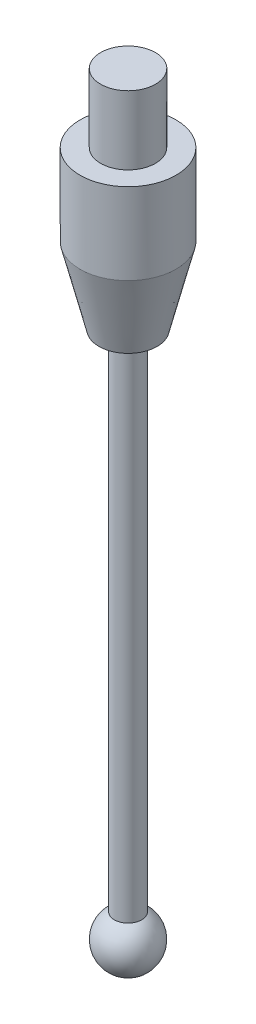
from build123d import *

# Parameters (mm, degrees)
SKETCH3_R           = 2
BOSS_EXTRUDE1_DEPTH = 5


with BuildPart() as part:
    # Sketch2 → Revolve1 (revolve)
    with BuildSketch(Plane.XY, mode=Mode.PRIVATE) as revolve1_sk:
        with BuildLine():
            Line((1, 1.732050808), (1, 38.5))
            Line((1, 38.5), (2.123066207, 38.5))
            Line((2.123066207, 38.5), (3.5, 44.068591296))
            Line((3.5, 44.068591296), (3.5, 50))
            Line((3.5, 50), (0, 50))
            Line((0, 50), (0, -2))
            ThreePointArc((0, -2), (1.931851653, -0.51763809), (1, 1.732050808))
        make_face()
    revolve(revolve1_sk.sketch.rotate(Axis((0, -2, 0), (0, 1, 0)), 90), axis=Axis((0, -2, 0), (0, 1, 0)))

    # Sketch3 → Boss-Extrude1 (add)
    with BuildSketch(Plane(origin=(0, 50, 0), x_dir=(1, 0, 0), z_dir=(0, 1, 0))):
        with Locations(Location((0, 0, 0), (0, 0, 90))):
            Circle(SKETCH3_R)
    extrude(amount=BOSS_EXTRUDE1_DEPTH)


solid = part.part
